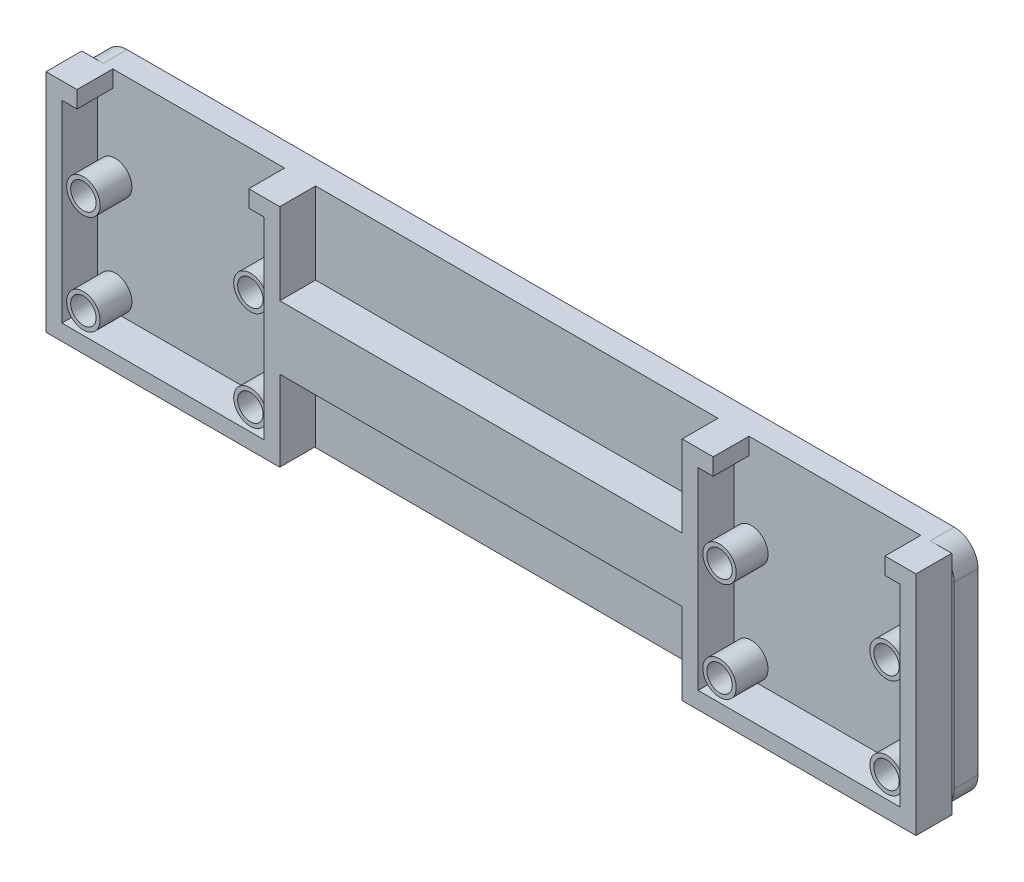
from build123d import *

# Parameters (mm, degrees)
SKETCH1_W                  = 110
SKETCH1_H                  = 28.5
BACKPLATE_BASE_DEPTH       = 3
OUTER_CORNER_FILLETS_R     = 3
SKETCH2_W                  = 29.4
SKETCH2_H                  = 28.381
SKETCH2_W_2                = 25.4
SKETCH2_H_2                = 24.262
SKETCH2_H_3                = 28.5
POCKET_WALLS_DEPTH         = 4.5
SKETCH3_W                  = 50.6
SKETCH3_H                  = 8
CENTER_BRIDGE_DEPTH        = 4.5
SKETCH4_W                  = 21.6
SKETCH4_H                  = 3
CSI_CABLE_EXIT_SLOTS_DEPTH = 4.5
STANDOFF_BOSSES_START      = 3
SKETCH5_R                  = 2.1
STANDOFF_BOSSES_DEPTH      = 4
SKETCH6_R                  = 1.6
M2_INSERT_HOLES_DEPTH      = 4.5


with BuildPart() as part:
    # Sketch1 → Backplate_Base (new body)
    with BuildSketch(Plane.XY):
        Rectangle(SKETCH1_W, SKETCH1_H)
    extrude(amount=BACKPLATE_BASE_DEPTH)

    # Outer_Corner_Fillets
    outer_corner_fillets_edges = [part.edges().sort_by_distance(p)[0] for p in [
        (-55, 14.25, 1.5),
        (55, 14.25, 1.5),
        (55, -14.25, 1.5),
        (-55, -14.25, 1.5),
    ]]
    fillet(outer_corner_fillets_edges, radius=OUTER_CORNER_FILLETS_R)

    # Sketch2 → Pocket_Walls (add)
    # profile 1 of 2: a face of its own
    with BuildSketch(Plane.XY.offset(3)):
        with Locations((-40, 0.0595)):
            Rectangle(SKETCH2_W, SKETCH2_H)
        with Locations((-40, 0)):
            Rectangle(SKETCH2_W_2, SKETCH2_H_2, mode=Mode.SUBTRACT)
    # profile 2 of 2: a face of its own
    with BuildSketch(Plane.XY.offset(3)):
        with Locations((40, 0)):
            Rectangle(SKETCH2_W, SKETCH2_H_3)
        with Locations((40, 0)):
            Rectangle(SKETCH2_W_2, SKETCH2_H_2, mode=Mode.SUBTRACT)
    extrude(amount=POCKET_WALLS_DEPTH)

    # Sketch3 → Center_Bridge (add)
    with BuildSketch(Plane.XY.offset(3)):
        Rectangle(SKETCH3_W, SKETCH3_H)
    extrude(amount=CENTER_BRIDGE_DEPTH)

    # Sketch4 → CSI_Cable_Exit_Slots (cut)
    with BuildSketch(Plane.XY.offset(7.5)):
        with Locations((-40, 13.131)):
            Rectangle(SKETCH4_W, SKETCH4_H)
        with Locations((40, 13.131)):
            Rectangle(SKETCH4_W, SKETCH4_H)
    extrude(amount=-CSI_CABLE_EXIT_SLOTS_DEPTH, mode=Mode.SUBTRACT)

    # Sketch5 → Standoff_Bosses (add)
    with BuildSketch(Plane.XY.offset(STANDOFF_BOSSES_START)):
        with Locations(Location((-50.5, -9.931, 0), (0, 0, 180))):
            Circle(SKETCH5_R)
        with Locations(Location((-29.5, -9.931, 0), (0, 0, 180))):
            Circle(SKETCH5_R)
        with Locations(Location((-50.5, 2.569, 0), (0, 0, 180))):
            Circle(SKETCH5_R)
        with Locations(Location((-29.5, 2.569, 0), (0, 0, 180))):
            Circle(SKETCH5_R)
        with Locations(Location((29.5, -9.931, 0), (0, 0, 180))):
            Circle(SKETCH5_R)
        with Locations(Location((50.5, -9.931, 0), (0, 0, 180))):
            Circle(SKETCH5_R)
        with Locations(Location((29.5, 2.569, 0), (0, 0, 180))):
            Circle(SKETCH5_R)
        with Locations(Location((50.5, 2.569, 0), (0, 0, 180))):
            Circle(SKETCH5_R)
    extrude(amount=STANDOFF_BOSSES_DEPTH)

    # Sketch6 → M2_Insert_Holes (cut)
    with BuildSketch(Plane.XY.offset(7)):
        with Locations((-50.5, -9.931)):
            Circle(SKETCH6_R)
        with Locations((-29.5, -9.931)):
            Circle(SKETCH6_R)
        with Locations((-50.5, 2.569)):
            Circle(SKETCH6_R)
        with Locations((-29.5, 2.569)):
            Circle(SKETCH6_R)
        with Locations((29.5, -9.931)):
            Circle(SKETCH6_R)
        with Locations((50.5, -9.931)):
            Circle(SKETCH6_R)
        with Locations((29.5, 2.569)):
            Circle(SKETCH6_R)
        with Locations((50.5, 2.569)):
            Circle(SKETCH6_R)
    extrude(amount=-M2_INSERT_HOLES_DEPTH, mode=Mode.SUBTRACT)


solid = part.part
